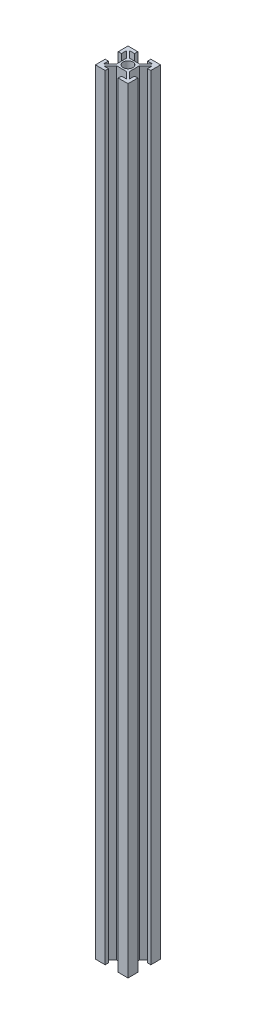
from build123d import *

# Parameters (mm, degrees)
BOSS_EXTRUDE1_START = -12.168666
F_2020_SKETCH_R     = 3
BOSS_EXTRUDE1_DEPTH = 475


with BuildPart() as part:
    # 2020 sketch → Boss-Extrude1 (new body)
    with BuildSketch(Plane(origin=(0, 0, 0), x_dir=(1, 0, 0), z_dir=(0, 1, 0)).offset(BOSS_EXTRUDE1_START)):
        Polygon((-4, 10), (-4, 8), (-7, 8), (-3, 4), (3, 4), (7, 8), (4, 8), (4, 10), (10, 10), (10, 4), (8, 4), (8, 7), (4, 3), (4, -3), (8, -7), (8, -4), (10, -4), (10, -10), (4, -10), (4, -8), (7, -8), (3, -4), (-3, -4), (-7, -8), (-4, -8), (-4, -10), (-10, -10), (-10, -4), (-8, -4), (-8, -7), (-4, -3), (-4, 3), (-8, 7), (-8, 4), (-10, 4), (-10, 10), align=None)
        with Locations(Location((0, 0, 0), (0, 0, 90))):
            Circle(F_2020_SKETCH_R, mode=Mode.SUBTRACT)
    extrude(amount=BOSS_EXTRUDE1_DEPTH)


solid = part.part
